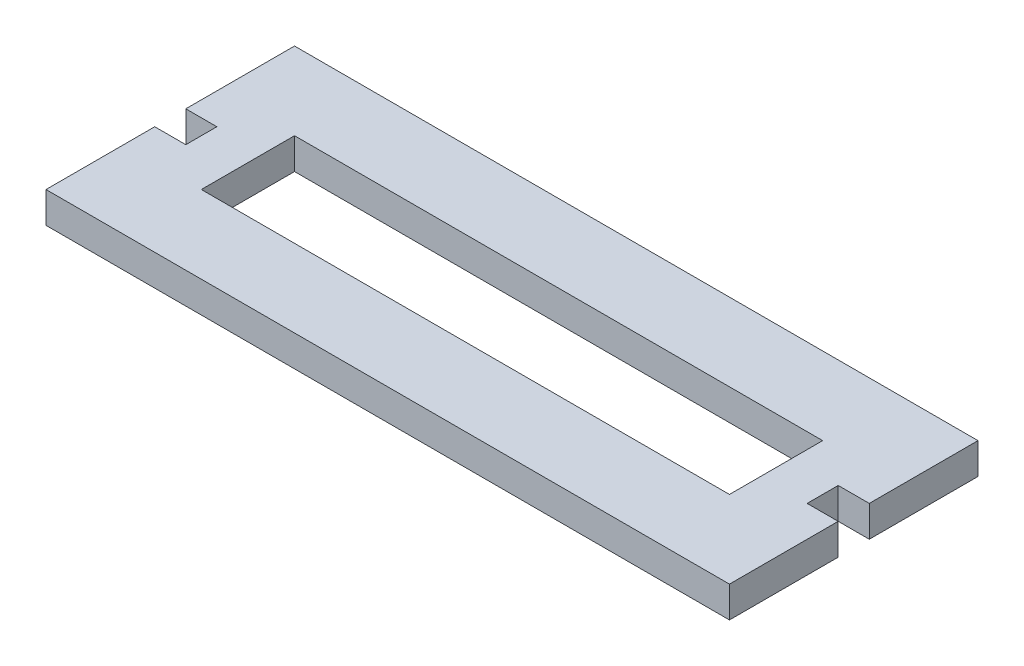
from build123d import *

# Parameters (mm, degrees)
SKETCH1_W           = 63.5
SKETCH1_H           = 25.4
SKETCH1_W_2         = 3.175
SKETCH1_H_2         = 11.1125
BOSS_EXTRUDE1_DEPTH = 3.175
SKETCH2_W           = 53.975
SKETCH2_H           = 9.525
CUT_EXTRUDE1_DEPTH  = 72.419858933


with BuildPart() as part:
    # Sketch1 → Boss-Extrude1 (new body)
    with BuildSketch(Plane(origin=(0, 0, 0), x_dir=(1, 0, 0), z_dir=(0, 1, 0))):
        with Locations((31.75, 12.7)):
            Rectangle(SKETCH1_W, SKETCH1_H)
        with Locations((-1.5875, 19.84375)):
            Rectangle(SKETCH1_W_2, SKETCH1_H_2)
        with Locations((-1.5875, 5.55625)):
            Rectangle(SKETCH1_W_2, SKETCH1_H_2)
        with Locations((65.0875, 19.84375)):
            Rectangle(SKETCH1_W_2, SKETCH1_H_2)
        with Locations((65.0875, 5.55625)):
            Rectangle(SKETCH1_W_2, SKETCH1_H_2)
    extrude(amount=BOSS_EXTRUDE1_DEPTH)

    # Sketch2 → Cut-Extrude1 (cut, through all)
    with BuildSketch(Plane(origin=(0, 3.175, 0), x_dir=(1, 0, 0), z_dir=(0, 1, 0))):
        with Locations((31.75, 12.7)):
            Rectangle(SKETCH2_W, SKETCH2_H)
    extrude(amount=-CUT_EXTRUDE1_DEPTH, mode=Mode.SUBTRACT)


solid = part.part
